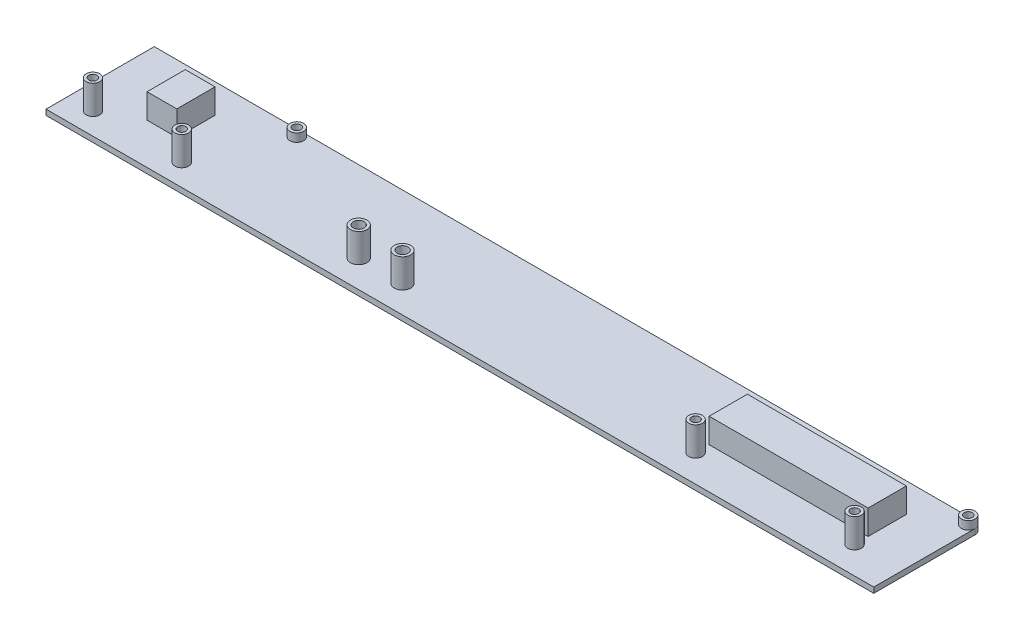
from build123d import *

# Parameters (mm, degrees)
SKETCH_1_W          = 250
SKETCH_1_H          = 39.5
EXTRUDE_1_DEPTH     = 2
SKETCH_2_R          = 2.5
SKETCH_2_R_2        = 1.5
EXTRUDE_2_DEPTH     = 3
FILLET_1_R          = 2.5
SKETCH_6_R          = 2.5
SKETCH_6_R_2        = 1.5
EXTRUDE_3_DEPTH     = 3
CUT_EXTRUDE_START   = -1
SKETCH_7_R          = 1.5
CUT_EXTRUDE_1_DEPTH = 1
SKETCH_8_R          = 1.5
CUT_EXTRUDE_2_DEPTH = 1
SKETCH_9_R          = 2.5
SKETCH_9_R_2        = 1.5
EXTRUDE_5_DEPTH     = 10.5
SKETCH_10_W         = 39.5
SKETCH_10_H         = 2
EXTRUDE_6_DEPTH     = 52
SKETCH_11_R         = 2.5
SKETCH_11_R_2       = 1.5
EXTRUDE_7_DEPTH     = 10.5
SKETCH_13_W         = 58
SKETCH_13_H         = 13.949858628
SKETCH_13_W_2       = 10.867061712
EXTRUDE_8_DEPTH     = 9
SKETCH_14_R         = 3
SKETCH_14_R_2       = 2
EXTRUDE_9_DEPTH     = 10.5


with BuildPart() as part:
    # 草图1 → 凸台-拉伸1 (new body)
    with BuildSketch(Plane(origin=(0, 0, 0), x_dir=(1, 0, 0), z_dir=(0, 1, 0))):
        with Locations((-84.429225121, -3.30093938)):
            Rectangle(SKETCH_1_W, SKETCH_1_H)
    extrude(amount=EXTRUDE_1_DEPTH)

    # 草图2 → 凸台-拉伸2 (add)
    with BuildSketch(Plane(origin=(0, 2, 0), x_dir=(1, 0, 0), z_dir=(0, 1, 0))):
        with Locations(Location((38.070774879, 13.94906062, 0), (0, 0, 90))):
            Circle(SKETCH_2_R)
        with Locations(Location((38.070774879, 13.94906062, 0), (0, 0, 270))):
            Circle(SKETCH_2_R_2, mode=Mode.SUBTRACT)
    extrude(amount=EXTRUDE_2_DEPTH)

    # 圆角1
    fillet_1_edges = [part.edges().sort_by_distance(p)[0] for p in [
        (40.570774879, 1, -16.44906062),
    ]]
    fillet(fillet_1_edges, radius=FILLET_1_R)

    # 草图6 → 凸台-拉伸3 (add)
    with BuildSketch(Plane(origin=(0, 2, 0), x_dir=(1, 0, 0), z_dir=(0, 1, 0))):
        with Locations(Location((-206.929225121, 13.94906062, 0), (0, 0, 90))):
            Circle(SKETCH_6_R)
        with Locations(Location((-206.929225121, 13.94906062, 0), (0, 0, 270))):
            Circle(SKETCH_6_R_2, mode=Mode.SUBTRACT)
    extrude(amount=EXTRUDE_3_DEPTH)

    # 草图7 → 切除-拉伸1 (cut)
    with BuildSketch(Plane(origin=(0, 2, 0), x_dir=(1, 0, 0), z_dir=(0, 1, 0)).offset(CUT_EXTRUDE_START)):
        with Locations(Location((38.070774879, 13.94906062, 0), (0, 0, 270))):
            Circle(SKETCH_7_R)
    extrude(amount=CUT_EXTRUDE_1_DEPTH, mode=Mode.SUBTRACT)

    # 草图8 → 切除-拉伸2 (cut)
    with BuildSketch(Plane(origin=(0, 2, 0), x_dir=(1, 0, 0), z_dir=(0, 1, 0)).offset(CUT_EXTRUDE_START)):
        with Locations(Location((-206.929225121, 13.94906062, 0), (0, 0, 270))):
            Circle(SKETCH_8_R)
    extrude(amount=CUT_EXTRUDE_2_DEPTH, mode=Mode.SUBTRACT)

    # 草图9 → 凸台-拉伸5 (add)
    # profile 1 of 2: a face of its own
    with BuildSketch(Plane(origin=(0, 2, 0), x_dir=(1, 0, 0), z_dir=(0, 1, 0))):
        with Locations(Location((23.570774879, -13.05093938, 0), (0, 0, 90))):
            Circle(SKETCH_9_R)
        with Locations(Location((23.570774879, -13.05093938, 0), (0, 0, 90))):
            Circle(SKETCH_9_R_2, mode=Mode.SUBTRACT)
    # profile 2 of 2: a face of its own
    with BuildSketch(Plane(origin=(0, 2, 0), x_dir=(1, 0, 0), z_dir=(0, 1, 0))):
        with Locations(Location((-34.429225121, -13.05093938, 0), (0, 0, 90))):
            Circle(SKETCH_9_R)
        with Locations(Location((-34.429225121, -13.05093938, 0), (0, 0, 90))):
            Circle(SKETCH_9_R_2, mode=Mode.SUBTRACT)
    extrude(amount=EXTRUDE_5_DEPTH)

    # 草图10 → 凸台-拉伸6 (add)
    with BuildSketch(Plane.ZY.offset(209.429225121)):
        with Locations((3.30093938, 1)):
            Rectangle(SKETCH_10_W, SKETCH_10_H)
    extrude(amount=EXTRUDE_6_DEPTH)

    # 草图11 → 凸台-拉伸7 (add)
    # profile 1 of 2: a face of its own
    with BuildSketch(Plane(origin=(0, 2, 0), x_dir=(1, 0, 0), z_dir=(0, 1, 0))):
        with Locations(Location((-252.299570288, -15.05093938, 0), (0, 0, 90))):
            Circle(SKETCH_11_R)
        with Locations(Location((-252.299570288, -15.05093938, 0), (0, 0, 90))):
            Circle(SKETCH_11_R_2, mode=Mode.SUBTRACT)
    # profile 2 of 2: a face of its own
    with BuildSketch(Plane(origin=(0, 2, 0), x_dir=(1, 0, 0), z_dir=(0, 1, 0))):
        with Locations(Location((-219.899570288, -15.05093938, 0), (0, 0, 90))):
            Circle(SKETCH_11_R)
        with Locations(Location((-219.899570288, -15.05093938, 0), (0, 0, 90))):
            Circle(SKETCH_11_R_2, mode=Mode.SUBTRACT)
    extrude(amount=EXTRUDE_7_DEPTH)

    # 草图13 → 凸台-拉伸8 (add)
    with BuildSketch(Plane(origin=(0, 2, 0), x_dir=(1, 0, 0), z_dir=(0, 1, 0))):
        with Locations((-5.429225121, -1.132807322)):
            Rectangle(SKETCH_13_W, SKETCH_13_H)
        with Locations((-234.073282944, -1.132807322)):
            Rectangle(SKETCH_13_W_2, SKETCH_13_H)
    extrude(amount=EXTRUDE_8_DEPTH)

    # 草图14 → 凸台-拉伸9 (add)
    # profile 1 of 2: a face of its own
    with BuildSketch(Plane(origin=(0, 2, 0), x_dir=(1, 0, 0), z_dir=(0, 1, 0))):
        with Locations(Location((-141.341724895, -13.05093938, 0), (0, 0, 90))):
            Circle(SKETCH_14_R)
        with Locations(Location((-141.341724895, -13.05093938, 0), (0, 0, 90))):
            Circle(SKETCH_14_R_2, mode=Mode.SUBTRACT)
    # profile 2 of 2: a face of its own
    with BuildSketch(Plane(origin=(0, 2, 0), x_dir=(1, 0, 0), z_dir=(0, 1, 0))):
        with Locations(Location((-157.341724895, -13.05093938, 0), (0, 0, 90))):
            Circle(SKETCH_14_R)
        with Locations(Location((-157.341724895, -13.05093938, 0), (0, 0, 90))):
            Circle(SKETCH_14_R_2, mode=Mode.SUBTRACT)
    extrude(amount=EXTRUDE_9_DEPTH)


solid = part.part
